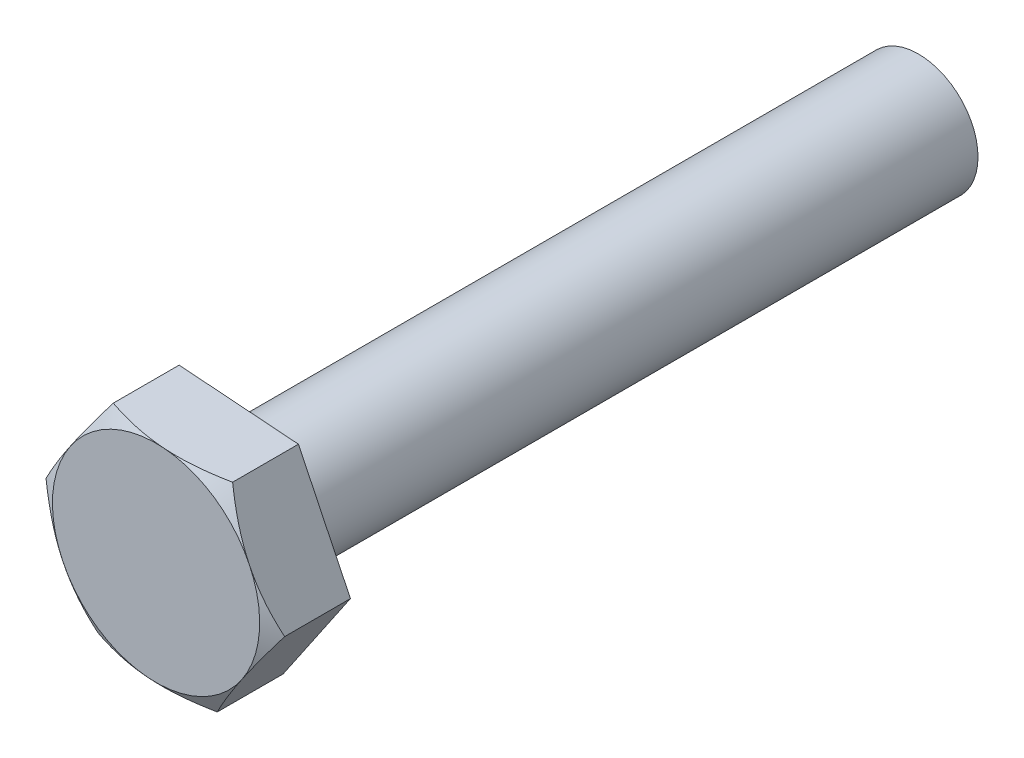
from build123d import *

# Parameters (mm, degrees)
BOSS_EXTRUDE1_DEPTH = 5.68
SKETCH2_OUTSIDE_W   = 44.722
SKETCH2_OUTSIDE_H   = 42.972
SKETCH2_OUTSIDE_R   = 7.837529904
CUT_EXTRUDE1_DEPTH  = 5.68
CUT_EXTRUDE1_DRAFT  = -60
SKETCH3_R           = 4.5
BOSS_EXTRUDE2_DEPTH = 52


with BuildPart() as part:
    # Sketch1 → Boss-Extrude1 (new body)
    with BuildSketch(Plane.XY):
        Polygon((5.091015355, 7.482249839), (-3.934310761, 8.150073548), (-9.025326116, 0.667823708), (-5.091015355, -7.482249839), (3.934310761, -8.150073548), (9.025326116, -0.667823708), align=None)
    extrude(amount=BOSS_EXTRUDE1_DEPTH)


with BuildPart() as cut_extrude1_tool:
    # Sketch2 outside → Cut-Extrude1 (with draft: the straight prism first)
    with BuildSketch(Plane.XY.offset(5.68)):
        Rectangle(SKETCH2_OUTSIDE_W, SKETCH2_OUTSIDE_H)
        Circle(SKETCH2_OUTSIDE_R, mode=Mode.SUBTRACT)
    extrude(amount=-CUT_EXTRUDE1_DEPTH)
    # Cut-Extrude1: the draft: its side faces are tilted about the plane it starts from
    cut_extrude1_sides = [cut_extrude1_tool.faces().sort_by_distance(p)[0] for p in [
        (0, -21.486, 2.84),
        (22.361, 0, 2.84),
        (0, 21.486, 2.84),
        (-22.361, 0, 2.84),
        (-7.837529904, 0, 2.84),
    ]]
    draft(cut_extrude1_sides, Plane.XY.offset(5.68), CUT_EXTRUDE1_DRAFT)


with BuildPart() as part_1:
    add(part.part)

    # Cut-Extrude1: cut by cut_extrude1_tool
    add(cut_extrude1_tool.part, mode=Mode.SUBTRACT)

    # Sketch3 → Boss-Extrude2 (add)
    with BuildSketch(Plane(origin=(0, 0, 0), x_dir=(-1, 0, 0), z_dir=(0, 0, -1))):
        with Locations(Location((0, 0, 0), (0, 0, 180))):
            Circle(SKETCH3_R)
    extrude(amount=BOSS_EXTRUDE2_DEPTH)


solid = part_1.part
